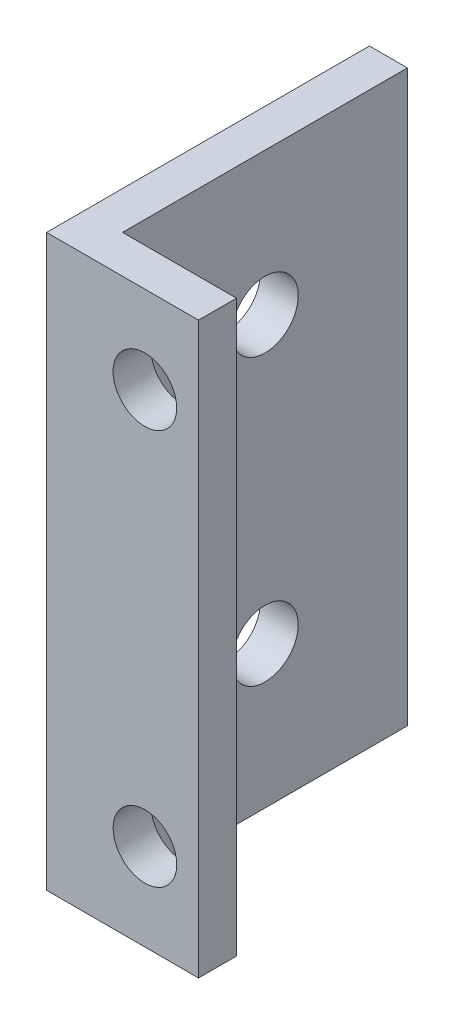
from build123d import *

# Parameters (mm, degrees)
BOSS_EXTRUDE1_DEPTH = 30
SKETCH2_R           = 1.675
CUT_EXTRUDE1_DEPTH  = 30
SKETCH3_R           = 1.75
CUT_EXTRUDE2_DEPTH  = 30


with BuildPart() as part:
    # Sketch1 → Boss-Extrude1 (new body)
    with BuildSketch(Plane(origin=(0, 0, 0), x_dir=(1, 0, 0), z_dir=(0, 1, 0))):
        Polygon((-2.53610988, 10.739698715), (-2.53610988, -4.260301285), (3.46389012, -4.260301285), (3.46389012, -6.260301285), (-4.53610988, -6.260301285), (-4.53610988, 10.739698715), align=None)
    extrude(amount=BOSS_EXTRUDE1_DEPTH)

    # Sketch2 → Cut-Extrude1 (cut)
    with BuildSketch(Plane(origin=(0, 0, 4.260301285), x_dir=(-1, 0, 0), z_dir=(0, 0, -1))):
        with Locations((-0.63889012, 25.414)):
            Circle(SKETCH2_R)
        with Locations((-0.64389012, 4.59)):
            Circle(SKETCH2_R)
    extrude(amount=-CUT_EXTRUDE1_DEPTH, mode=Mode.SUBTRACT)

    # Sketch3 → Cut-Extrude2 (cut)
    with BuildSketch(Plane(origin=(-2.53610988, 0, 0), x_dir=(0, 0, -1), z_dir=(1, 0, 0))):
        with Locations((3.239698715, 22.5)):
            Circle(SKETCH3_R)
        with Locations((3.239698715, 7.5)):
            Circle(SKETCH3_R)
    extrude(amount=-CUT_EXTRUDE2_DEPTH, mode=Mode.SUBTRACT)


solid = part.part
